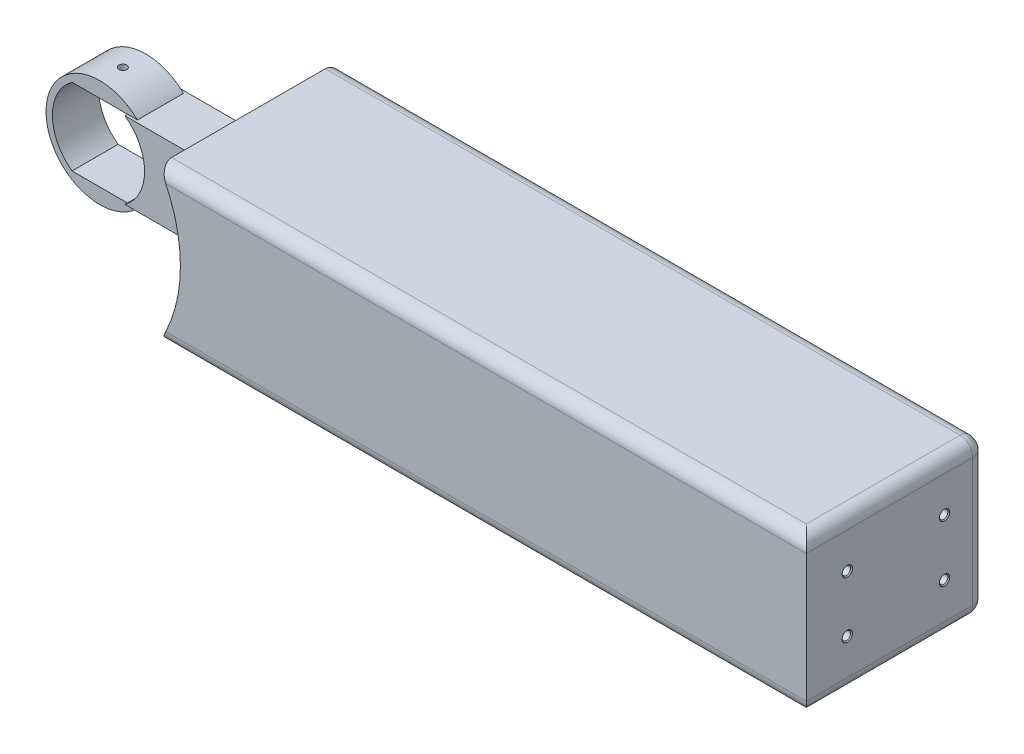
from build123d import *

# Parameters (mm, degrees)
SKETCH2_W                   = 20
SKETCH2_H                   = 30
SKETCH2_W_2                 = 14
SKETCH2_H_2                 = 24
BOSS_EXTRUDE1_DEPTH         = 302
SKETCH9_W                   = 70
SKETCH9_H                   = 60
BOSS_EXTRUDE2_DEPTH         = 3
BOSS_EXTRUDE3_DEPTH         = 9
BOSS_EXTRUDE3_DEPTH_BACK    = 9
SKETCH10_R                  = 21
SKETCH10_R_2                = 18.5
CUT_EXTRUDE1_DEPTH          = 19
CUT_EXTRUDE1_DEPTH_BACK     = 19
SKETCH14_W                  = 70
SKETCH14_H                  = 60
BOSS_EXTRUDE5_DEPTH         = 10
BOSS_EXTRUDE6_REACH         = 315.409
BOSS_EXTRUDE6_END_RADIUS    = 57.5
SKETCH15_W                  = 70
SKETCH15_H                  = 60
SKETCH15_W_2                = 60
SKETCH15_H_2                = 50
SKETCH16_W                  = 247.387457627
SKETCH16_H                  = 20
BOSS_EXTRUDE7_DEPTH         = 10
FILLET1_R                   = 5
M4_TAPPED_HOLE1_D           = 3.3
M4_TAPPED_HOLE1_DEPTH       = 8.008579979
M4_TAPPED_HOLE1_CSINK_D     = 4.05
M4_TAPPED_HOLE1_CSINK_ANGLE = 90
M4_TAPPED_HOLE1_TIP         = 0.991420021
SKETCH19_R                  = 1.525
CUT_EXTRUDE3_DEPTH          = 10


with BuildPart() as part:
    # Sketch2 → Boss-Extrude1 (new body)
    with BuildSketch(Plane(origin=(0, 0, 0), x_dir=(0, 0, -1), z_dir=(1, 0, 0))):
        Rectangle(SKETCH2_W, SKETCH2_H)
        Rectangle(SKETCH2_W_2, SKETCH2_H_2, mode=Mode.SUBTRACT)
    extrude(amount=BOSS_EXTRUDE1_DEPTH)

    # Sketch9 → Boss-Extrude2 (add)
    with BuildSketch(Plane(origin=(302, 0, 0), x_dir=(0, 0, -1), z_dir=(1, 0, 0))):
        Rectangle(SKETCH9_W, SKETCH9_H)
    extrude(amount=-BOSS_EXTRUDE2_DEPTH)

    # Sketch10 → Boss-Extrude3 (add, two sides: drawn at the far end of the back side and taken through both)
    # profile 1 of 3: a face of its own
    with BuildSketch(Plane.XY.offset(-BOSS_EXTRUDE3_DEPTH_BACK)):
        Circle(SKETCH10_R)
        Circle(SKETCH10_R_2, mode=Mode.SUBTRACT)
    # profile 2 of 3: a face of its own
    with BuildSketch(Plane.XY.offset(-BOSS_EXTRUDE3_DEPTH_BACK)):
        with BuildLine():
            ThreePointArc((10.828203914, 15), (0, 18.5), (-10.828203914, 15))
            Line((-10.828203914, 15), (10.828203914, 15))
        make_face()
    # profile 3 of 3: a face of its own
    with BuildSketch(Plane.XY.offset(-BOSS_EXTRUDE3_DEPTH_BACK)):
        with BuildLine():
            ThreePointArc((-10.828203914, -15), (0, -18.5), (10.828203914, -15))
            Line((10.828203914, -15), (-10.828203914, -15))
        make_face()
    extrude(amount=BOSS_EXTRUDE3_DEPTH + BOSS_EXTRUDE3_DEPTH_BACK)

    # Sketch10<3> → Cut-Extrude1 (cut, two sides: drawn at the far end of the back side and taken through both)
    with BuildSketch(Plane.XY.offset(-CUT_EXTRUDE1_DEPTH_BACK)):
        with BuildLine():
            Line((-10.828203914, -15), (10.828203914, -15))
            ThreePointArc((10.828203914, -15), (16.470758519, -8.42402005), (18.5, 0))
            ThreePointArc((18.5, 0), (16.470758519, 8.42402005), (10.828203914, 15))
            Line((10.828203914, 15), (-10.828203914, 15))
            ThreePointArc((-10.828203914, 15), (-18.5, 0), (-10.828203914, -15))
        make_face()
    extrude(amount=CUT_EXTRUDE1_DEPTH + CUT_EXTRUDE1_DEPTH_BACK, mode=Mode.SUBTRACT)

    # Sketch14 → Boss-Extrude5 (add)
    with BuildSketch(Plane.ZY.offset(-299)):
        Rectangle(SKETCH14_W, SKETCH14_H)
    extrude(amount=BOSS_EXTRUDE5_DEPTH)

    # Boss-Extrude6: up to this cylinder (the profile starts outside it)
    boss_extrude6_end = Plane(origin=(0, 0, 0), z_dir=(0, 0, -1)) * Cylinder(BOSS_EXTRUDE6_END_RADIUS, 746.818, mode=Mode.PRIVATE)
    # Sketch15 → Boss-Extrude6 (add, up to the surface)
    with BuildSketch(Plane.ZY.offset(-289), mode=Mode.PRIVATE) as boss_extrude6_sk1:
        Rectangle(SKETCH15_W, SKETCH15_H)
        Rectangle(SKETCH15_W_2, SKETCH15_H_2, mode=Mode.SUBTRACT)
    boss_extrude6_tool1 = extrude(boss_extrude6_sk1.sketch, amount=BOSS_EXTRUDE6_REACH, mode=Mode.PRIVATE) - boss_extrude6_end
    add(boss_extrude6_tool1.solids().sort_by_distance((289, -29.078046, 0))[0])

    # Sketch16 → Boss-Extrude7 (add)
    with BuildSketch(Plane(origin=(0, 15, 0), x_dir=(1, 0, 0), z_dir=(0, 1, 0))):
        with Locations((178.306271186, 0)):
            Rectangle(SKETCH16_W, SKETCH16_H)
    extrude(amount=BOSS_EXTRUDE7_DEPTH)

    # Fillet1
    fillet1_edges = [part.edges().sort_by_distance(p)[0] for p in [
        (302, -30, 0),
        (302, 0, -35),
        (175.526771088, -30, 35),
        (302, 30, 0),
        (175.526771088, 30, 35),
        (175.526771088, 30, -35),
        (175.526771088, -30, -35),
    ]]
    fillet(fillet1_edges, radius=FILLET1_R)

    # M4 Tapped Hole1
    with Locations(Plane(origin=(302, 0, 0), x_dir=(0, 0, -1), z_dir=(1, 0, 0))):
        with Locations((-19, 11), (19, 11), (-19, -11), (19, -11)):
            CounterSinkHole(M4_TAPPED_HOLE1_D / 2, M4_TAPPED_HOLE1_CSINK_D / 2, depth=M4_TAPPED_HOLE1_DEPTH, counter_sink_angle=M4_TAPPED_HOLE1_CSINK_ANGLE)
            with Locations((0, 0, -(M4_TAPPED_HOLE1_DEPTH + M4_TAPPED_HOLE1_TIP / 2))):  # 118° drill point
                Cone(0, M4_TAPPED_HOLE1_D / 2, M4_TAPPED_HOLE1_TIP, mode=Mode.SUBTRACT)

    # Sketch19 → Cut-Extrude3 (cut)
    with BuildSketch(Plane.XZ.offset(-15)):
        with Locations(Location((0, 0, 0), (0, 0, 270))):
            Circle(SKETCH19_R)
    extrude(amount=-CUT_EXTRUDE3_DEPTH, mode=Mode.SUBTRACT)


solid = part.part
